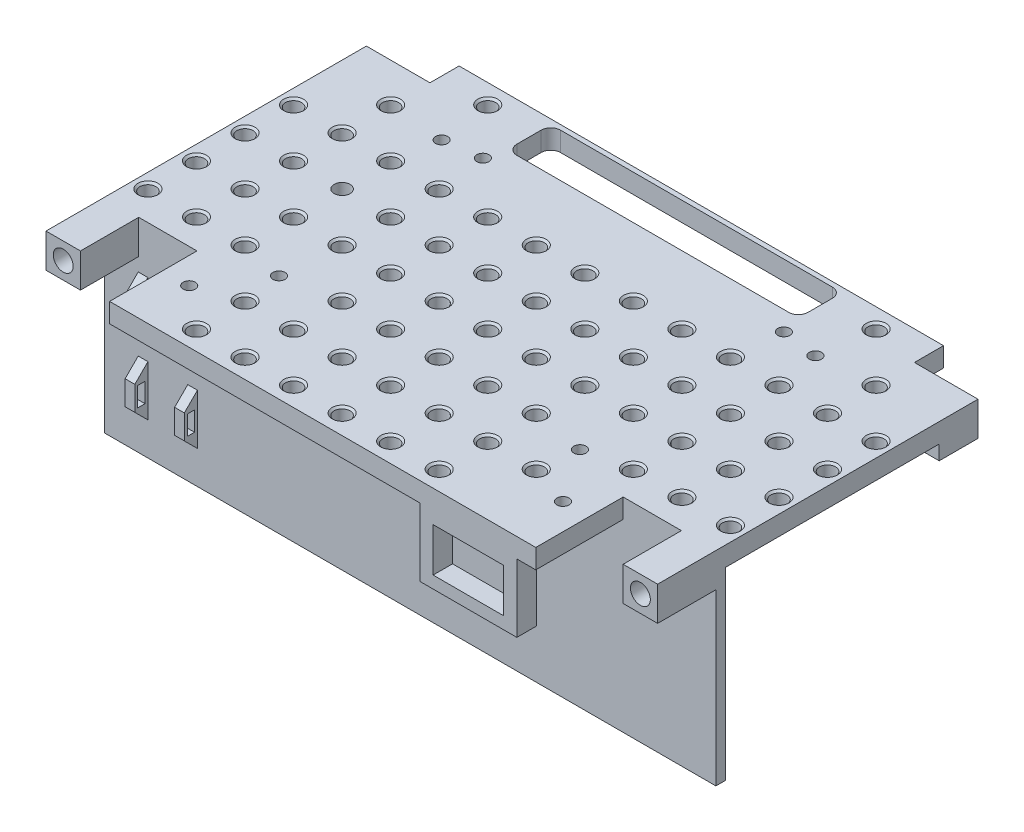
from build123d import *

# Parameters (mm, degrees)
BOSS_EXTRUDE1_DEPTH             = 4
SKETCH3_W                       = 7.1
SKETCH3_H                       = 8
BOSS_EXTRUDE3_DEPTH             = 3
SKETCH4_R                       = 2.05
CUT_EXTRUDE1_DEPTH              = 7
MIRROR2_COPY_1_SKETCH_W         = 7.1
MIRROR2_COPY_1_SKETCH_H         = 8
MIRROR2_COPY_1_DEPTH            = 3
MIRROR2_COPY_2_SKETCH_R         = 2.05
MIRROR2_COPY_2_DEPTH            = 7
SKETCH5_W                       = 60
SKETCH5_H                       = 9
CUT_EXTRUDE2_DEPTH              = 75.953318806
FILLET1_R                       = 2
SKETCH7_W                       = 111.8
SKETCH7_H                       = 1
CUT_EXTRUDE3_DEPTH              = 75.953318806
SKETCH8_W                       = 126
SKETCH8_H                       = 2
BOSS_EXTRUDE4_DEPTH             = 38
SKETCH9_W                       = 12
SKETCH9_H                       = 18
CUT_EXTRUDE4_DEPTH              = 10
SKETCH10_W                      = 7.1
SKETCH10_H                      = 4
BOSS_EXTRUDE5_DEPTH             = 3
SKETCH12_W                      = 1.5
SKETCH12_H                      = 4
BOSS_EXTRUDE6_DEPTH             = 2
SKETCH13_W                      = 40
SKETCH13_H                      = 2
BOSS_EXTRUDE7_DEPTH             = 38
SKETCH14_W                      = 1.5
SKETCH14_H                      = 4
BOSS_EXTRUDE8_DEPTH             = 1
BOSS_EXTRUDE9_REACH             = 85.271
BOSS_EXTRUDE9_DIRECTION_2_REACH = 85.271
SKETCH16_W                      = 20
SKETCH16_H                      = 14
SKETCH16_W_2                    = 14.5
SKETCH16_H_2                    = 9
BOSS_EXTRUDE10_DEPTH            = 4
SKETCH17_W                      = 12
SKETCH17_H                      = 18
CUT_EXTRUDE5_DEPTH              = 84.270643086
SKETCH18_W                      = 6
SKETCH18_H                      = 6
CUT_EXTRUDE6_DEPTH              = 86.170417399
SKETCH22_R                      = 1.25
CUT_EXTRUDE7_DEPTH              = 4
SKETCH23_R                      = 1.65
CUT_EXTRUDE8_DEPTH              = 86.170417399
MIRROR5_COPY_1_SKETCH_R         = 1.65
MIRROR5_COPY_1_DEPTH            = 86.170417399
SKETCH24_R                      = 1.65
CUT_EXTRUDE9_DEPTH              = 86.170417399
CHAMFER1_SIZE                   = 0.4
SKETCH6_R                       = 1.25
CUT_EXTRUDE10_DEPTH             = 4


with BuildPart() as part:
    # Sketch1 → Boss-Extrude1 (new body)
    with BuildSketch(Plane(origin=(0, 0, 0), x_dir=(1, 0, 0), z_dir=(0, 1, 0))):
        Polygon((-63, -33), (-55.9, -33), (-55.9, -40), (55.9, -40), (55.9, -33), (63, -33), (63, 33), (55.9, 33), (55.9, 40), (-55.9, 40), (-55.9, 33), (-63, 33), align=None)
    extrude(amount=BOSS_EXTRUDE1_DEPTH)

    # Sketch3 → Boss-Extrude3 (add)
    with BuildSketch(Plane.XZ):
        with Locations((-59.45, -29)):
            Rectangle(SKETCH3_W, SKETCH3_H)
    boss_extrude3 = extrude(amount=BOSS_EXTRUDE3_DEPTH)

    # Sketch4 → Cut-Extrude1 (cut)
    with BuildSketch(Plane(origin=(0, 0, -33), x_dir=(-1, 0, 0), z_dir=(0, 0, -1))):
        with Locations((59.45, 0.5)):
            Circle(SKETCH4_R)
    cut_extrude1 = extrude(amount=-CUT_EXTRUDE1_DEPTH, mode=Mode.SUBTRACT)

    # Mirror1: Boss-Extrude3, Cut-Extrude1 across plane
    add(boss_extrude3.mirror(Plane(origin=(0, 0, 0), x_dir=(0, 0, 1), z_dir=(1, 0, 0))))
    add(cut_extrude1.mirror(Plane(origin=(0, 0, 0), x_dir=(0, 0, 1), z_dir=(1, 0, 0))), mode=Mode.SUBTRACT)

    # Mirror2: Boss-Extrude3, Cut-Extrude1 across plane
    add(boss_extrude3.mirror(Plane.XY))
    add(cut_extrude1.mirror(Plane.XY), mode=Mode.SUBTRACT)

    # Mirror2 copy 1 sketch → Mirror2 copy 1 (add)
    with BuildSketch(Plane(origin=(0, 0, 0), x_dir=(-1, 0, 0), z_dir=(0, -1, 0))):
        with Locations((-59.45, -29)):
            Rectangle(MIRROR2_COPY_1_SKETCH_W, MIRROR2_COPY_1_SKETCH_H)
    extrude(amount=MIRROR2_COPY_1_DEPTH)

    # Mirror2 copy 2 sketch → Mirror2 copy 2 (cut)
    with BuildSketch(Plane.XY.offset(33)):
        with Locations((59.45, 0.5)):
            Circle(MIRROR2_COPY_2_SKETCH_R)
    extrude(amount=-MIRROR2_COPY_2_DEPTH, mode=Mode.SUBTRACT)

    # Sketch5 → Cut-Extrude2 (cut, through all)
    with BuildSketch(Plane(origin=(0, 4, 0), x_dir=(1, 0, 0), z_dir=(0, 1, 0))):
        with Locations((0, 33.5)):
            Rectangle(SKETCH5_W, SKETCH5_H)
    extrude(amount=-CUT_EXTRUDE2_DEPTH, mode=Mode.SUBTRACT)

    # Fillet1
    fillet1_edges = [part.edges().sort_by_distance(p)[0] for p in [
        (-30, 2, -29),
        (-30, 2, -38),
        (30, 2, -38),
        (30, 2, -29),
    ]]
    fillet(fillet1_edges, radius=FILLET1_R)

    # Sketch7 → Cut-Extrude3 (cut, through all)
    with BuildSketch(Plane(origin=(0, 4, 0), x_dir=(1, 0, 0), z_dir=(0, 1, 0))):
        with Locations((0, 39.5)):
            Rectangle(SKETCH7_W, SKETCH7_H)
        with Locations((0, -39.5)):
            Rectangle(SKETCH7_W, SKETCH7_H)
    extrude(amount=-CUT_EXTRUDE3_DEPTH, mode=Mode.SUBTRACT)

    # Sketch8 → Boss-Extrude4 (add)
    with BuildSketch(Plane.XZ):
        with Locations((0, 20)):
            Rectangle(SKETCH8_W, SKETCH8_H)
    extrude(amount=BOSS_EXTRUDE4_DEPTH)

    # Sketch9 → Cut-Extrude4 (cut)
    with BuildSketch(Plane(origin=(0, 4, 0), x_dir=(1, 0, 0), z_dir=(0, 1, 0))):
        with Locations((-49.9, -30)):
            Rectangle(SKETCH9_W, SKETCH9_H)
    extrude(amount=-CUT_EXTRUDE4_DEPTH, mode=Mode.SUBTRACT)

    # Sketch10 → Boss-Extrude5 (add)
    with BuildSketch(Plane.XZ.offset(3)):
        with Locations((-59.45, 23)):
            Rectangle(SKETCH10_W, SKETCH10_H)
        with Locations((59.45, 23)):
            Rectangle(SKETCH10_W, SKETCH10_H)
    extrude(amount=-BOSS_EXTRUDE5_DEPTH)

    # Sketch12 → Boss-Extrude6 (add)
    # profile 1 of 2: a face of its own
    with BuildSketch(Plane.ZY.offset(56)):
        Polygon((21, -5.8), (21, -16.2), (23.7, -13.5), (23.7, -8.5), align=None)
        with Locations((22.35, -11)):
            Rectangle(SKETCH12_W, SKETCH12_H, mode=Mode.SUBTRACT)
    # profile 2 of 2: a face of its own
    with BuildSketch(Plane.ZY.offset(56)):
        Polygon((21, -20.8), (21, -31.2), (23.7, -28.5), (23.7, -23.5), align=None)
        with Locations((22.35, -26)):
            Rectangle(SKETCH12_W, SKETCH12_H, mode=Mode.SUBTRACT)
    boss_extrude6 = extrude(amount=-BOSS_EXTRUDE6_DEPTH)

    # Mirror3: Boss-Extrude6 across plane
    add(boss_extrude6.mirror(Plane(origin=(-49.9, 0, 0), x_dir=(0, 0, 1), z_dir=(1, 0, 0))))

    # Sketch13 → Boss-Extrude7 (add)
    with BuildSketch(Plane.XZ):
        with Locations((0, -21.5)):
            Rectangle(SKETCH13_W, SKETCH13_H)
    extrude(amount=BOSS_EXTRUDE7_DEPTH)

    # Sketch14 → Boss-Extrude8 (add, symmetric)
    # profile 1 of 2: a face of its own
    with BuildSketch(Plane(origin=(0, 0, 0), x_dir=(0, 0, -1), z_dir=(1, 0, 0))):
        Polygon((25.2, -8.5), (22.5, -5.8), (22.5, -16.2), (25.2, -13.5), align=None)
        with Locations((23.85, -11)):
            Rectangle(SKETCH14_W, SKETCH14_H, mode=Mode.SUBTRACT)
    # profile 2 of 2: a face of its own
    with BuildSketch(Plane(origin=(0, 0, 0), x_dir=(0, 0, -1), z_dir=(1, 0, 0))):
        Polygon((25.2, -28.5), (25.2, -23.5), (22.5, -20.8), (22.5, -31.2), align=None)
        with Locations((23.85, -26)):
            Rectangle(SKETCH14_W, SKETCH14_H, mode=Mode.SUBTRACT)
    extrude(amount=BOSS_EXTRUDE8_DEPTH, both=True)

    # Boss-Extrude9: up to this face of the body (flat: up to its plane)
    boss_extrude9_end = Plane(part.part.faces().sort_by_distance((-20, -19, -21.5))[0])
    # Sketch15 → Boss-Extrude9 (add, up to the picked face)
    with BuildSketch(Plane(origin=(0, 0, 0), x_dir=(0, 0, -1), z_dir=(1, 0, 0)), mode=Mode.PRIVATE) as boss_extrude9_sk1:
        Polygon((20.5, 0), (20.5, -5), (17.613248654, 0), align=None)
    boss_extrude9_tool1 = split(extrude(boss_extrude9_sk1.sketch, amount=-BOSS_EXTRUDE9_REACH, mode=Mode.PRIVATE), bisect_by=boss_extrude9_end, keep=Keep.BOTH, mode=Mode.PRIVATE)
    add(boss_extrude9_tool1.solids().sort_by(Axis((0, -1.666667, -19.53775), (-1, 0, 0)))[0])

    # Boss-Extrude9 direction 2: up to this face of the body (flat: up to its plane)
    boss_extrude9_direction_2_end = Plane(part.part.faces().sort_by_distance((20, -19, -21.5))[0])
    # Sketch15 → Boss-Extrude9 direction 2 (add, up to the picked face)
    with BuildSketch(Plane(origin=(0, 0, 0), x_dir=(0, 0, -1), z_dir=(1, 0, 0)), mode=Mode.PRIVATE) as boss_extrude9_direction_2_sk1:
        Polygon((20.5, 0), (20.5, -5), (17.613248654, 0), align=None)
    boss_extrude9_direction_2_tool1 = split(extrude(boss_extrude9_direction_2_sk1.sketch, amount=BOSS_EXTRUDE9_DIRECTION_2_REACH, mode=Mode.PRIVATE), bisect_by=boss_extrude9_direction_2_end, keep=Keep.BOTH, mode=Mode.PRIVATE)
    add(boss_extrude9_direction_2_tool1.solids().sort_by(Axis((0, -1.666667, -19.53775), (1, 0, 0)))[0])

    # Sketch16 → Boss-Extrude10 (add)
    with BuildSketch(Plane.XY.offset(39)):
        with Locations((30, -7)):
            Rectangle(SKETCH16_W, SKETCH16_H)
        with Locations((30, -7)):
            Rectangle(SKETCH16_W_2, SKETCH16_H_2, mode=Mode.SUBTRACT)
    extrude(amount=-BOSS_EXTRUDE10_DEPTH)

    # Sketch17 → Cut-Extrude5 (cut, through all)
    with BuildSketch(Plane.XZ):
        with Locations((49.9, 30)):
            Rectangle(SKETCH17_W, SKETCH17_H)
    extrude(amount=-CUT_EXTRUDE5_DEPTH, mode=Mode.SUBTRACT)

    # Sketch18 → Cut-Extrude6 (cut, through all)
    with BuildSketch(Plane(origin=(0, 4, 0), x_dir=(1, 0, 0), z_dir=(0, 1, 0))):
        with Locations((52.9, 36)):
            Rectangle(SKETCH18_W, SKETCH18_H)
        with Locations((-52.9, 36)):
            Rectangle(SKETCH18_W, SKETCH18_H)
    extrude(amount=-CUT_EXTRUDE6_DEPTH, mode=Mode.SUBTRACT)

    # Sketch22 → Cut-Extrude7 (cut)
    with BuildSketch(Plane(origin=(0, 4, 0), x_dir=(1, 0, 0), z_dir=(0, 1, 0))):
        with Locations(Location((-31, 25, 0), (0, 0, 270))):
            Circle(SKETCH22_R)
        with Locations(Location((31, 25, 0), (0, 0, 270))):
            Circle(SKETCH22_R)
        with Locations(Location((31, -17, 0), (0, 0, 270))):
            Circle(SKETCH22_R)
        with Locations(Location((-31, -17, 0), (0, 0, 270))):
            Circle(SKETCH22_R)
    extrude(amount=-CUT_EXTRUDE7_DEPTH, mode=Mode.SUBTRACT)

    # Sketch23 → Cut-Extrude8 (cut, through all)
    with BuildSketch(Plane(origin=(0, 4, 0), x_dir=(1, 0, 0), z_dir=(0, 1, 0))):
        with Locations(Location((0, -5, 0), (0, 0, 270))):
            Circle(SKETCH23_R)
        with Locations(Location((0, -15, 0), (0, 0, 270))):
            Circle(SKETCH23_R)
        with Locations(Location((-10, -5, 0), (0, 0, 270))):
            Circle(SKETCH23_R)
        with Locations(Location((-20, -5, 0), (0, 0, 270))):
            Circle(SKETCH23_R)
        with Locations(Location((-30, -5, 0), (0, 0, 270))):
            Circle(SKETCH23_R)
        with Locations(Location((-40, -5, 0), (0, 0, 270))):
            Circle(SKETCH23_R)
        with Locations(Location((-50, -5, 0), (0, 0, 270))):
            Circle(SKETCH23_R)
        with Locations(Location((-60, -5, 0), (0, 0, 270))):
            Circle(SKETCH23_R)
        with Locations(Location((-60, -15, 0), (0, 0, 270))):
            Circle(SKETCH23_R)
        with Locations(Location((-50, -15, 0), (0, 0, 270))):
            Circle(SKETCH23_R)
        with Locations(Location((-40, -15, 0), (0, 0, 270))):
            Circle(SKETCH23_R)
        with Locations(Location((-20, -15, 0), (0, 0, 270))):
            Circle(SKETCH23_R)
        with Locations(Location((-10, -15, 0), (0, 0, 270))):
            Circle(SKETCH23_R)
    cut_extrude8 = extrude(amount=-CUT_EXTRUDE8_DEPTH, mode=Mode.SUBTRACT)

    # Mirror4: Cut-Extrude8 across plane
    add(cut_extrude8.mirror(Plane.XY), mode=Mode.SUBTRACT)

    # Mirror5: Cut-Extrude8 across plane
    add(cut_extrude8.mirror(Plane(origin=(0, 0, 0), x_dir=(0, 0, 1), z_dir=(1, 0, 0))), mode=Mode.SUBTRACT)

    # Mirror5 copy 1 sketch → Mirror5 copy 1 (cut, through all)
    with BuildSketch(Plane(origin=(0, 4, 0), x_dir=(-1, 0, 0), z_dir=(0, 1, 0))):
        with Locations(Location((0, -5, 0), (0, 0, 270))):
            Circle(MIRROR5_COPY_1_SKETCH_R)
        with Locations(Location((0, -15, 0), (0, 0, 270))):
            Circle(MIRROR5_COPY_1_SKETCH_R)
        with Locations(Location((-10, -5, 0), (0, 0, 270))):
            Circle(MIRROR5_COPY_1_SKETCH_R)
        with Locations(Location((-20, -5, 0), (0, 0, 270))):
            Circle(MIRROR5_COPY_1_SKETCH_R)
        with Locations(Location((-30, -5, 0), (0, 0, 270))):
            Circle(MIRROR5_COPY_1_SKETCH_R)
        with Locations(Location((-40, -5, 0), (0, 0, 270))):
            Circle(MIRROR5_COPY_1_SKETCH_R)
        with Locations(Location((-50, -5, 0), (0, 0, 270))):
            Circle(MIRROR5_COPY_1_SKETCH_R)
        with Locations(Location((-60, -5, 0), (0, 0, 270))):
            Circle(MIRROR5_COPY_1_SKETCH_R)
        with Locations(Location((-60, -15, 0), (0, 0, 270))):
            Circle(MIRROR5_COPY_1_SKETCH_R)
        with Locations(Location((-50, -15, 0), (0, 0, 270))):
            Circle(MIRROR5_COPY_1_SKETCH_R)
        with Locations(Location((-40, -15, 0), (0, 0, 270))):
            Circle(MIRROR5_COPY_1_SKETCH_R)
        with Locations(Location((-20, -15, 0), (0, 0, 270))):
            Circle(MIRROR5_COPY_1_SKETCH_R)
        with Locations(Location((-10, -15, 0), (0, 0, 270))):
            Circle(MIRROR5_COPY_1_SKETCH_R)
    extrude(amount=-MIRROR5_COPY_1_DEPTH, mode=Mode.SUBTRACT)

    # Sketch24 → Cut-Extrude9 (cut, through all)
    with BuildSketch(Plane(origin=(0, 4, 0), x_dir=(1, 0, 0), z_dir=(0, 1, 0))):
        with Locations(Location((-30, 15, 0), (0, 0, 270))):
            Circle(SKETCH24_R)
        with Locations(Location((30, 15, 0), (0, 0, 270))):
            Circle(SKETCH24_R)
        with Locations(Location((-40, 35, 0), (0, 0, 270))):
            Circle(SKETCH24_R)
        with Locations(Location((-50, 25, 0), (0, 0, 270))):
            Circle(SKETCH24_R)
        with Locations(Location((50, 25, 0), (0, 0, 270))):
            Circle(SKETCH24_R)
        with Locations(Location((40, 35, 0), (0, 0, 270))):
            Circle(SKETCH24_R)
        with Locations(Location((30, -25, 0), (0, 0, 270))):
            Circle(SKETCH24_R)
        with Locations(Location((-30, -25, 0), (0, 0, 270))):
            Circle(SKETCH24_R)
        with Locations(Location((-30, -35, 0), (0, 0, 270))):
            Circle(SKETCH24_R)
        with Locations(Location((-10, -25, 0), (0, 0, 270))):
            Circle(SKETCH24_R)
        with Locations(Location((-10, -35, 0), (0, 0, 270))):
            Circle(SKETCH24_R)
        with Locations(Location((0, -25, 0), (0, 0, 270))):
            Circle(SKETCH24_R)
        with Locations(Location((0, -35, 0), (0, 0, 270))):
            Circle(SKETCH24_R)
        with Locations(Location((10, -25, 0), (0, 0, 270))):
            Circle(SKETCH24_R)
        with Locations(Location((10, -35, 0), (0, 0, 270))):
            Circle(SKETCH24_R)
        with Locations(Location((20, -35, 0), (0, 0, 270))):
            Circle(SKETCH24_R)
        with Locations(Location((20, -25, 0), (0, 0, 270))):
            Circle(SKETCH24_R)
        with Locations(Location((-20, -25, 0), (0, 0, 270))):
            Circle(SKETCH24_R)
        with Locations(Location((-20, -35, 0), (0, 0, 270))):
            Circle(SKETCH24_R)
    extrude(amount=-CUT_EXTRUDE9_DEPTH, mode=Mode.SUBTRACT)

    # Chamfer1
    chamfer1_edges = [part.edges().sort_by_distance(p)[0] for p in [
        (0, 0, 13.35),
        (0, 4, 13.35),
        (-10, 0, 13.35),
        (-10, 4, 13.35),
        (-10, 0, 3.35),
        (-10, 4, 3.35),
        (-20, 0, 3.35),
        (-20, 4, 3.35),
        (-30, 0, 3.35),
        (-30, 4, 3.35),
        (-40, 0, 3.35),
        (-40, 4, 3.35),
        (-50, 0, 3.35),
        (-50, 4, 3.35),
        (-60, 0, 3.35),
        (-60, 4, 3.35),
        (-60, 0, 13.35),
        (-60, 4, 13.35),
        (-50, 0, 13.35),
        (-50, 4, 13.35),
        (-40, 0, 13.35),
        (-40, 4, 13.35),
        (-20, 0, 13.35),
        (-20, 4, 13.35),
        (0, 0, 3.35),
        (0, 4, 3.35),
        (0, 4, -13.35),
        (0, 0, -13.35),
        (-10, 4, -13.35),
        (-10, 0, -13.35),
        (-10, 4, -3.35),
        (-10, 0, -3.35),
        (-20, 4, -3.35),
        (-20, 0, -3.35),
        (-30, 4, -3.35),
        (-30, 0, -3.35),
        (-50, 4, -3.35),
        (-50, 0, -3.35),
        (-60, 4, -3.35),
        (-60, 0, -3.35),
        (-60, 4, -13.35),
        (-60, 0, -13.35),
        (-50, 4, -13.35),
        (-50, 0, -13.35),
        (-40, 4, -13.35),
        (-40, 0, -13.35),
        (-20, 4, -13.35),
        (-20, 0, -13.35),
        (0, 4, -3.35),
        (0, 0, -3.35),
        (10, 0, -13.35),
        (10, 4, -13.35),
        (10, 0, -3.35),
        (10, 4, -3.35),
        (20, 0, -3.35),
        (20, 4, -3.35),
        (30, 0, -3.35),
        (30, 4, -3.35),
        (40, 0, -3.35),
        (40, 4, -3.35),
        (50, 0, -3.35),
        (50, 4, -3.35),
        (60, 0, -3.35),
        (60, 4, -3.35),
        (60, 0, -13.35),
        (60, 4, -13.35),
        (50, 0, -13.35),
        (50, 4, -13.35),
        (40, 0, -13.35),
        (40, 4, -13.35),
        (20, 0, -13.35),
        (20, 4, -13.35),
        (10, 4, 13.35),
        (10, 0, 13.35),
        (10, 4, 3.35),
        (10, 0, 3.35),
        (20, 4, 3.35),
        (20, 0, 3.35),
        (30, 4, 3.35),
        (30, 0, 3.35),
        (40, 4, 3.35),
        (40, 0, 3.35),
        (50, 4, 3.35),
        (50, 0, 3.35),
        (60, 4, 3.35),
        (60, 0, 3.35),
        (60, 4, 13.35),
        (60, 0, 13.35),
        (50, 4, 13.35),
        (50, 0, 13.35),
        (40, 4, 13.35),
        (40, 0, 13.35),
        (20, 4, 13.35),
        (20, 0, 13.35),
        (20, 0, 23.35),
        (20, 4, 23.35),
        (20, 4, 33.35),
        (10, 0, 33.35),
        (10, 4, 33.35),
        (10, 0, 23.35),
        (10, 4, 23.35),
        (0, 0, 33.35),
        (0, 4, 33.35),
        (0, 0, 23.35),
        (0, 4, 23.35),
        (-10, 0, 33.35),
        (-10, 4, 33.35),
        (-10, 0, 23.35),
        (-10, 4, 23.35),
        (50, 0, -26.65),
        (50, 4, -26.65),
        (-50, 0, -26.65),
        (-50, 4, -26.65),
        (-40, 0, -36.65),
        (-40, 4, -36.65),
        (30, 0, -16.65),
        (30, 4, -16.65),
        (40, 0, -36.65),
        (40, 4, -36.65),
        (30, 0, 23.35),
        (30, 4, 23.35),
        (-30, 0, 23.35),
        (-30, 4, 23.35),
        (-30, 0, 33.35),
        (-30, 4, 33.35),
        (-20, 0, 33.35),
        (-20, 4, 33.35),
        (-20, 0, 23.35),
        (-20, 4, 23.35),
        (-30, 0, -16.65),
        (-30, 4, -16.65),
    ]]
    chamfer(chamfer1_edges, length=CHAMFER1_SIZE)

    # Sketch6 → Cut-Extrude10 (cut)
    with BuildSketch(Plane(origin=(0, 4, 0), x_dir=(1, 0, 0), z_dir=(0, 1, 0))):
        with Locations(Location((-38.5, 24, 0), (0, 0, 270))):
            Circle(SKETCH6_R)
        with Locations(Location((38.5, 24, 0), (0, 0, 270))):
            Circle(SKETCH6_R)
        with Locations(Location((38.5, -28, 0), (0, 0, 270))):
            Circle(SKETCH6_R)
        with Locations(Location((-38.5, -28, 0), (0, 0, 270))):
            Circle(SKETCH6_R)
    extrude(amount=-CUT_EXTRUDE10_DEPTH, mode=Mode.SUBTRACT)


solid = part.part
